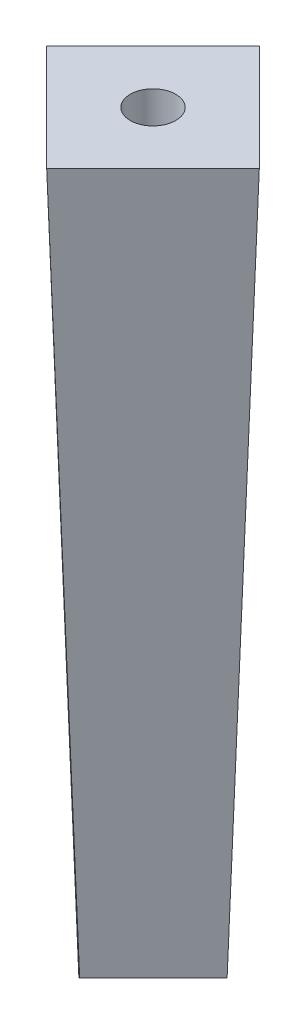
from build123d import *

# Parameters (mm, degrees)
BOSS_EXTRUDE1_DEPTH = 22.225
SKETCH4_W           = 42.895640362
SKETCH4_H           = 166.52307566
CUT_EXTRUDE2_DEPTH  = 22.225
CIRPATTERN1_COUNT   = 4
SKETCH5_R           = 4.7625
CUT_EXTRUDE3_DEPTH  = 190.365652901


with BuildPart() as part:
    # Sketch1 → Boss-Extrude1 (new body)
    with BuildSketch(Plane.XY):
        Polygon((75.93611291, 50.130135743), (91.347997502, 50.130135743), (91.347997502, 200.018674704), (69.122997502, 200.018674704), align=None)
    boss_extrude1 = extrude(amount=BOSS_EXTRUDE1_DEPTH)

    # Sketch4 → Cut-Extrude2 (cut)
    with BuildSketch(Plane(origin=(39.013250999, 1.751956449, -39.013250999), x_dir=(0.7060390157604001, 0.031705883905462015, 0.7074628224506635), z_dir=(-0.7067505605587739, -0.03173783703590832, 0.7067505605587739))):
        with Locations((68.323098286, 123.218808293)):
            Rectangle(SKETCH4_W, SKETCH4_H)
    cut_extrude2 = extrude(amount=CUT_EXTRUDE2_DEPTH, mode=Mode.SUBTRACT)

    # CirPattern1: Boss-Extrude1, Cut-Extrude2 ×4 about axis
    cirpattern1_axis = Axis((91.347997502, 0, 0), (0, 1, 0))
    add([boss_extrude1.rotate(cirpattern1_axis, i * 360 / CIRPATTERN1_COUNT) for i in range(1, CIRPATTERN1_COUNT)])
    add([cut_extrude2.rotate(cirpattern1_axis, i * 360 / CIRPATTERN1_COUNT) for i in range(1, CIRPATTERN1_COUNT)], mode=Mode.SUBTRACT)

    # Sketch5 → Cut-Extrude3 (cut, through all)
    with BuildSketch(Plane(origin=(0, 200.018674704, 0), x_dir=(1, 0, 0), z_dir=(0, 1, 0))):
        with Locations(Location((91.347997502, 0, 0), (0, 0, 270))):
            Circle(SKETCH5_R)
    extrude(amount=-CUT_EXTRUDE3_DEPTH, mode=Mode.SUBTRACT)


solid = part.part
